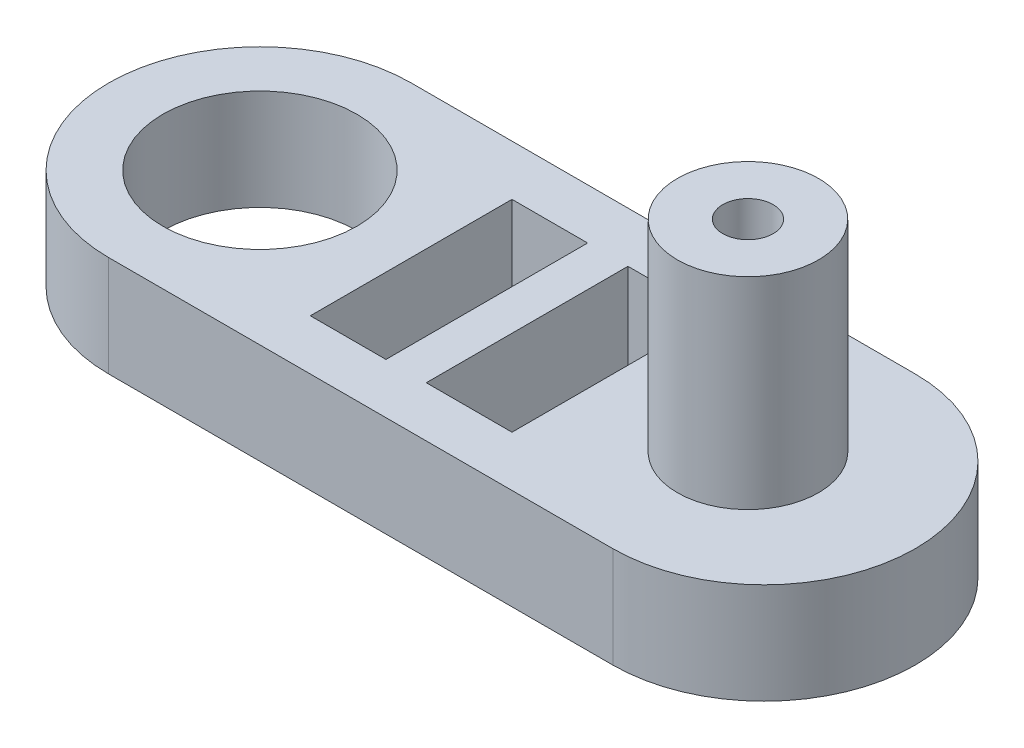
from build123d import *

# Parameters (mm, degrees)
SKETCH1_R           = 9.625
BOSS_EXTRUDE1_DEPTH = 10
SKETCH2_W           = 20
SKETCH2_H           = 20
CUT_EXTRUDE1_DEPTH  = 66.913290189
BOSS_EXTRUDE2_REACH = 70.881
SKETCH4_W           = 4
SKETCH4_H           = 10
SKETCH5_R           = 7
BOSS_EXTRUDE3_DEPTH = 20
SKETCH8_R           = 2.5
CUT_EXTRUDE2_DEPTH  = 10


with BuildPart() as part:
    # Sketch1 → Boss-Extrude1 (new body)
    with BuildSketch(Plane(origin=(0, 0, 0), x_dir=(1, 0, 0), z_dir=(0, 1, 0))):
        with BuildLine():
            Line((-48.400014381, 15), (1.599985619, 15))
            ThreePointArc((1.599985619, 15), (16.599985619, 0), (1.599985619, -15))
            Line((1.599985619, -15), (-48.400014381, -15))
            ThreePointArc((-48.400014381, -15), (-63.400014381, 0), (-48.400014381, 15))
        make_face()
        with Locations(Location((-48.400014381, 0, 0), (0, 0, 270))):
            Circle(SKETCH1_R, mode=Mode.SUBTRACT)
    extrude(amount=BOSS_EXTRUDE1_DEPTH)

    # Sketch2 → Cut-Extrude1 (cut, through all)
    with BuildSketch(Plane(origin=(0, 10, 0), x_dir=(1, 0, 0), z_dir=(0, 1, 0))):
        with Locations((-23.400014381, 0)):
            Rectangle(SKETCH2_W, SKETCH2_H)
    extrude(amount=-CUT_EXTRUDE1_DEPTH, mode=Mode.SUBTRACT)

    # Sketch4 → Boss-Extrude2 (add, up to next)
    with BuildSketch(Plane.XY.offset(-10), mode=Mode.PRIVATE) as boss_extrude2_sk1:
        with Locations((-23.900014381, 5)):
            Rectangle(SKETCH4_W, SKETCH4_H)
    boss_extrude2_tool1 = extrude(boss_extrude2_sk1.sketch, amount=BOSS_EXTRUDE2_REACH, mode=Mode.PRIVATE) - part.part
    add(boss_extrude2_tool1.solids().sort_by_distance((-23.900014, 5, -10))[0])

    # Sketch5 → Boss-Extrude3 (add)
    with BuildSketch(Plane(origin=(0, 10, 0), x_dir=(1, 0, 0), z_dir=(0, 1, 0))):
        with Locations(Location((0, 0, 0), (0, 0, 270))):
            Circle(SKETCH5_R)
    extrude(amount=BOSS_EXTRUDE3_DEPTH)

    # Sketch8 → Cut-Extrude2 (cut)
    with BuildSketch(Plane(origin=(0, 30, 0), x_dir=(1, 0, 0), z_dir=(0, 1, 0))):
        with Locations(Location((0, 0, 0), (0, 0, 270))):
            Circle(SKETCH8_R)
    extrude(amount=-CUT_EXTRUDE2_DEPTH, mode=Mode.SUBTRACT)


solid = part.part
